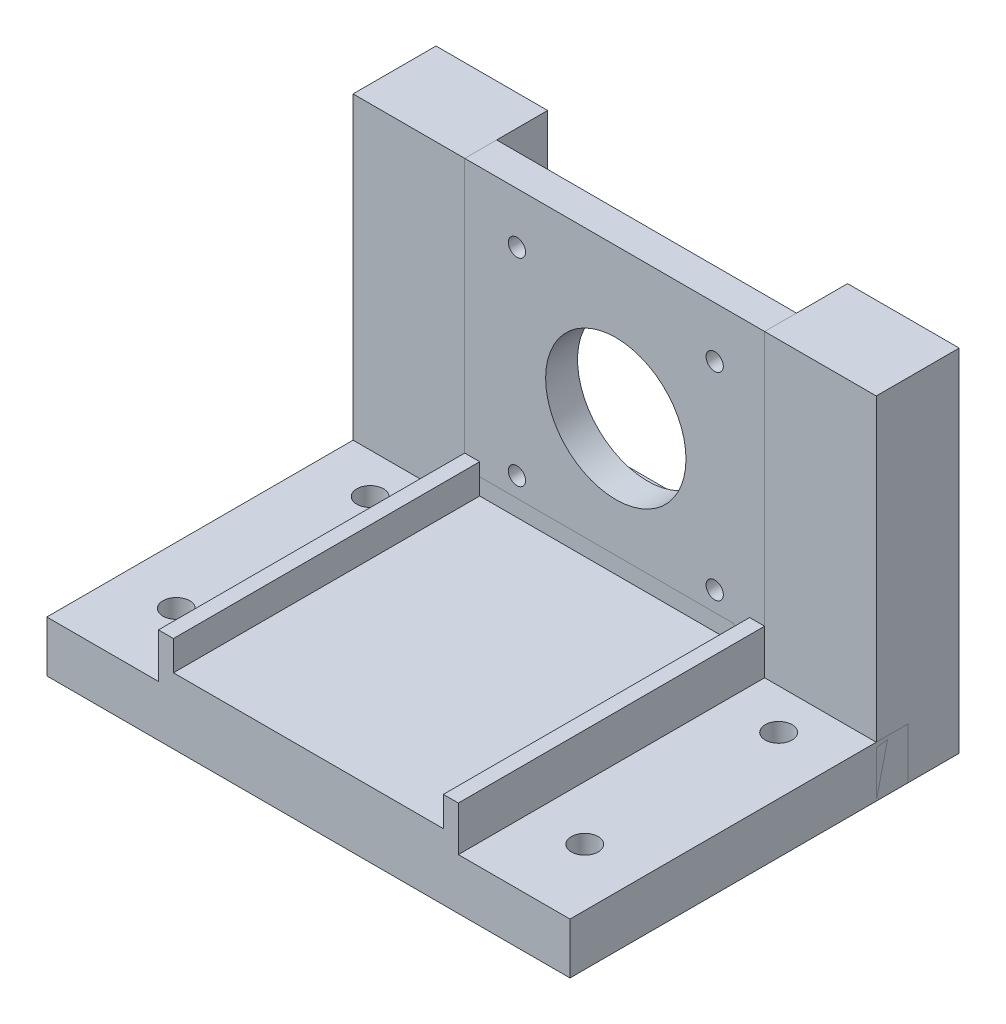
from build123d import *

# Parameters (mm, degrees)
SKETCH_1_W               = 47
SKETCH_1_H               = 47
EXTRUDE_1_DEPTH          = 53
SKETCH_2_W               = 42.3
SKETCH_2_H               = 42.3
CUT_EXTRUDE_1_DEPTH      = 48
CUT_EXTRUDE_2_DEPTH      = 59.38236035
CUT_EXTRUDE_2_DEPTH_BACK = 59.38236035
SKETCH_3_R               = 11
SKETCH_3_R_2             = 1.35
SKETCH_7_W               = 48
SKETCH_7_H               = 40
CUT_EXTRUDE_5_DEPTH      = 47.5
SKETCH_16_W              = 47
SKETCH_16_H              = 53
EXTRUDE_4_DEPTH          = 8
SKETCH_17_W              = 82
SKETCH_17_H              = 53
SKETCH_17_R              = 2.1
EXTRUDE_5_DEPTH          = 8
EXTRUDE_17_DEPTH         = 8
EXTRUDE_17_DEPTH_BACK    = 5
SKETCH_24_R              = 4.1
CUT_EXTRUDE_6_DEPTH      = 10


with BuildPart() as part:
    # Эскиз1 → Бобышка-Вытянуть1 (new body)
    with BuildSketch(Plane.XY):
        Rectangle(SKETCH_1_W, SKETCH_1_H)
    extrude(amount=EXTRUDE_1_DEPTH)

    # Эскиз2 → Вырез-Вытянуть1 (cut)
    with BuildSketch(Plane.XY.offset(53)):
        Rectangle(SKETCH_2_W, SKETCH_2_H)
    extrude(amount=-CUT_EXTRUDE_1_DEPTH, mode=Mode.SUBTRACT)

    # Эскиз3 → Вырез-Вытянуть2 (cut, two sides: drawn at the far end of the back side and taken through both)
    with BuildSketch(Plane.XY.offset(5).offset(-CUT_EXTRUDE_2_DEPTH_BACK)):
        with Locations((0.178742266, 0.022649375)):
            Circle(SKETCH_3_R)
        with Locations((-15.321257734, 15.522649375)):
            Circle(SKETCH_3_R_2)
        with Locations(Location((15.678742266, 15.522649375, 0), (0, 0, 180))):
            Circle(SKETCH_3_R_2)
        with Locations((15.678742266, -15.477350625)):
            Circle(SKETCH_3_R_2)
        with Locations(Location((-15.321257734, -15.477350625, 0), (0, 0, 180))):
            Circle(SKETCH_3_R_2)
    extrude(amount=CUT_EXTRUDE_2_DEPTH + CUT_EXTRUDE_2_DEPTH_BACK, mode=Mode.SUBTRACT)

    # Эскиз7 → Вырез-Вытянуть5 (cut)
    with BuildSketch(Plane(origin=(23.5, 0, 0), x_dir=(0, 0, -1), z_dir=(1, 0, 0))):
        with Locations((-29, 3.5)):
            Rectangle(SKETCH_7_W, SKETCH_7_H)
    extrude(amount=-CUT_EXTRUDE_5_DEPTH, mode=Mode.SUBTRACT)

    # Эскиз16 → Бобышка-Вытянуть4 (add)
    with BuildSketch(Plane.XZ.offset(23.5)):
        with Locations((0, 26.5)):
            Rectangle(SKETCH_16_W, SKETCH_16_H)
    extrude(amount=EXTRUDE_4_DEPTH)

    # Эскиз17 → Бобышка-Вытянуть5 (add)
    with BuildSketch(Plane.XZ.offset(31.5)):
        with Locations((0, 26.5)):
            Rectangle(SKETCH_17_W, SKETCH_17_H)
        with Locations(Location((-32.008542265, 41.692513381, 0), (0, 0, 270))):
            Circle(SKETCH_17_R, mode=Mode.SUBTRACT)
        with Locations(Location((-32.008542265, 11.307486619, 0), (0, 0, 90))):
            Circle(SKETCH_17_R, mode=Mode.SUBTRACT)
        with Locations(Location((32.008542265, 11.307486619, 0), (0, 0, 270))):
            Circle(SKETCH_17_R, mode=Mode.SUBTRACT)
        with Locations(Location((32.008542265, 41.692513381, 0), (0, 0, 90))):
            Circle(SKETCH_17_R, mode=Mode.SUBTRACT)
    extrude(amount=-EXTRUDE_5_DEPTH)


with BuildPart() as body_2:
    # Эскиз22 → Бобышка-Вытянуть17 (new, two sides: drawn at the far end of the back side and taken through both)
    with BuildSketch(Plane(origin=(0, 0, 0), x_dir=(-1, 0, 0), z_dir=(0, 0, -1)).offset(-EXTRUDE_17_DEPTH_BACK)):
        Polygon((-23.5, 23.5), (-41, 23.5), (-41, -31.5), (41, -31.5), (41, 23.5), (23.5, 23.5), (23.5, -18.547479391), (-23.5, -18.547479391), align=None)
    extrude(amount=EXTRUDE_17_DEPTH + EXTRUDE_17_DEPTH_BACK)

    # Эскиз24 → Вырез-Вытянуть6 (cut)
    with BuildSketch(Plane(origin=(0, 0, -8), x_dir=(-1, 0, 0), z_dir=(0, 0, -1))):
        with Locations((-32.25, -0.427350625)):
            Circle(SKETCH_24_R)
        with Locations((32.25, -0.427350625)):
            Circle(SKETCH_24_R)
    extrude(amount=-CUT_EXTRUDE_6_DEPTH, mode=Mode.SUBTRACT)


solid = Compound([part.part, body_2.part])
